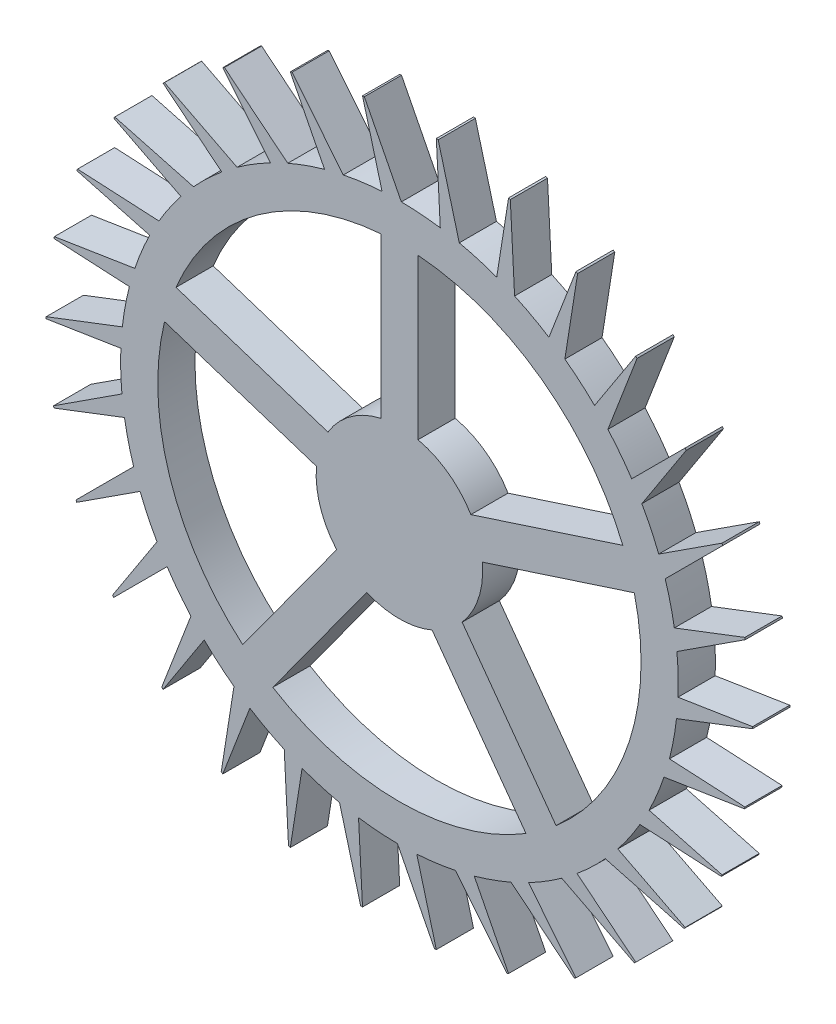
from build123d import *

# Parameters (mm, degrees)
BOSS_EXTRUDE1_DEPTH = 10


with BuildPart() as part:
    # Sketch1 → Boss-Extrude1 (new body)
    with BuildSketch(Plane.XY):
        with BuildLine():
            Line((74.53305982, -8.356015427), (94.998684211, -0.499998269))
            ThreePointArc((94.998684211, -0.499998269), (94.999671052, -0.25), (95, 0))
            Line((95, 0), (74.932623244, -3.178360236))
            ThreePointArc((74.932623244, -3.178360236), (74.971224988, 2.077359809), (74.641646935, 7.322878048))
            Line((74.641646935, 7.322878048), (93.026690519, 19.262264953))
            ThreePointArc((93.026690519, 19.262264953), (92.975678233, 19.507005335), (92.92402207, 19.751610628))
            Line((92.92402207, 19.751610628), (73.955983893, 12.470462957))
            ThreePointArc((73.955983893, 12.470462957), (72.901016456, 17.619358663), (71.488035907, 22.681726613))
            Line((71.488035907, 22.681726613), (86.98898406, 38.182674765))
            ThreePointArc((86.98898406, 38.182674765), (86.888202128, 38.411460933), (86.786818476, 38.639981092))
            Line((86.786818476, 38.639981092), (69.747113167, 27.574267078))
            ThreePointArc((69.747113167, 27.574267078), (67.644683687, 32.391306996), (65.210054673, 37.049274885))
            Line((65.210054673, 37.049274885), (77.149441578, 55.43431847))
            ThreePointArc((77.149441578, 55.43431847), (77.003294654, 55.637151368), (76.856614466, 55.839598968))
            Line((76.856614466, 55.839598968), (62.489958911, 41.472943413))
            ThreePointArc((62.489958911, 41.472943413), (59.431953645, 45.747599783), (56.082081137, 49.797592063))
            Line((56.082081137, 49.797592063), (63.938098295, 70.263216454))
            ThreePointArc((63.938098295, 70.263216454), (63.752973701, 70.431231313), (63.567407604, 70.59875842))
            Line((63.567407604, 70.59875842), (52.50169359, 53.559053111))
            ThreePointArc((52.50169359, 53.559053111), (48.621762043, 57.104502938), (44.503051544, 60.369515513))
            Line((44.503051544, 60.369515513), (47.932353308, 82.021274718))
            ThreePointArc((47.932353308, 82.021274718), (47.716341877, 82.147128482), (47.5, 82.27241336))
            Line((47.5, 82.27241336), (40.218852329, 63.304375183))
            ThreePointArc((40.218852329, 63.304375183), (35.686566127, 65.965665297), (30.979025049, 68.30300145))
            Line((30.979025049, 68.30300145), (29.831734476, 90.194609696))
            ThreePointArc((29.831734476, 90.194609696), (29.594276944, 90.272801951), (29.356614466, 90.350369048))
            Line((29.356614466, 90.350369048), (26.178254229, 70.282992292))
            ThreePointArc((26.178254229, 70.282992292), (21.191696027, 71.943811544), (16.101066505, 73.251318469))
            Line((16.101066505, 73.251318469), (10.427325699, 94.426007428))
            ThreePointArc((10.427325699, 94.426007428), (10.1788001, 94.453120798), (9.93020401, 94.47958006))
            Line((9.93020401, 94.47958006), (10.993540803, 74.189905382))
            ThreePointArc((10.993540803, 74.189905382), (5.770647123, 74.777668002), (0.519414094, 74.998201372))
            Line((0.519414094, 74.998201372), (-9.432807247, 94.530535529))
            ThreePointArc((-9.432807247, 94.530535529), (-9.681539152, 94.50538503), (-9.93020401, 94.47958006))
            Line((-9.93020401, 94.47958006), (-4.67164311, 74.854363605))
            ThreePointArc((-4.67164311, 74.854363605), (-9.902606752, 74.343381545), (-15.084939206, 73.467302994))
            Line((-15.084939206, 73.467302994), (-28.880681253, 90.50362562))
            ThreePointArc((-28.880681253, 90.50362562), (-29.118748686, 90.427310449), (-29.356614466, 90.350369048))
            Line((-29.356614466, 90.350369048), (-20.132653802, 72.247326946))
            ThreePointArc((-20.132653802, 72.247326946), (-25.143069193, 70.659932575), (-30.030008276, 68.72553094))
            Line((-30.030008276, 68.72553094), (-47.066330903, 82.521272987))
            ThreePointArc((-47.066330903, 82.521272987), (-47.283329175, 82.397128482), (-47.5, 82.27241336))
            Line((-47.5, 82.27241336), (-34.713770915, 66.48273542))
            ThreePointArc((-34.713770915, 66.48273542), (-39.284658861, 63.888305488), (-43.662621886, 60.980123402))
            Line((-43.662621886, 60.980123402), (-63.194956043, 70.932344743))
            ThreePointArc((-63.194956043, 70.932344743), (-63.381401289, 70.765796616), (-63.567407604, 70.59875842))
            Line((-63.567407604, 70.59875842), (-47.777729664, 57.812529335))
            ThreePointArc((-47.777729664, 57.812529335), (-51.709320428, 54.324452881), (-55.386969402, 50.569591856))
            Line((-55.386969402, 50.569591856), (-76.561658361, 56.243332663))
            ThreePointArc((-76.561658361, 56.243332663), (-76.709402028, 56.041659866), (-76.856614466, 55.839598968))
            Line((-76.856614466, 55.839598968), (-58.753572364, 46.615638304))
            ThreePointArc((-58.753572364, 46.615638304), (-61.874036564, 42.386361005), (-64.690640579, 37.948926486))
            Line((-64.690640579, 37.948926486), (-86.582248825, 39.09621706))
            ThreePointArc((-86.582248825, 39.09621706), (-86.684833806, 38.868233661), (-86.786818476, 38.639981092))
            Line((-86.786818476, 38.639981092), (-67.161602021, 33.381420192))
            ThreePointArc((-67.161602021, 33.381420192), (-69.334560397, 28.595781762), (-71.167020343, 23.66971093))
            Line((-71.167020343, 23.66971093), (-92.818779548, 20.240409167))
            ThreePointArc((-92.818779548, 20.240409167), (-92.871722387, 19.996079136), (-92.92402207, 19.751610628))
            Line((-92.92402207, 19.751610628), (-72.634347392, 18.688273835))
            ThreePointArc((-72.634347392, 18.688273835), (-73.764831237, 13.555429637), (-74.53305982, 8.356015427))
            Line((-74.53305982, 8.356015427), (-94.998684211, 0.499998269))
            ThreePointArc((-94.998684211, 0.499998269), (-94.999671052, 0.25), (-95, 0))
            Line((-95, 0), (-74.932623244, 3.178360236))
            ThreePointArc((-74.932623244, 3.178360236), (-74.971224988, -2.077359809), (-74.641646935, -7.322878048))
            Line((-74.641646935, -7.322878048), (-93.026690519, -19.262264953))
            ThreePointArc((-93.026690519, -19.262264953), (-92.975678233, -19.507005335), (-92.92402207, -19.751610628))
            Line((-92.92402207, -19.751610628), (-73.955983893, -12.470462957))
            ThreePointArc((-73.955983893, -12.470462957), (-72.901016456, -17.619358663), (-71.488035907, -22.681726613))
            Line((-71.488035907, -22.681726613), (-86.98898406, -38.182674765))
            ThreePointArc((-86.98898406, -38.182674765), (-86.888202128, -38.411460933), (-86.786818476, -38.639981092))
            Line((-86.786818476, -38.639981092), (-69.747113167, -27.574267078))
            ThreePointArc((-69.747113167, -27.574267078), (-67.644683687, -32.391306996), (-65.210054673, -37.049274885))
            Line((-65.210054673, -37.049274885), (-77.149441578, -55.43431847))
            ThreePointArc((-77.149441578, -55.43431847), (-77.003294654, -55.637151368), (-76.856614466, -55.839598968))
            Line((-76.856614466, -55.839598968), (-62.489958911, -41.472943413))
            ThreePointArc((-62.489958911, -41.472943413), (-59.431953645, -45.747599783), (-56.082081137, -49.797592063))
            Line((-56.082081137, -49.797592063), (-63.938098295, -70.263216454))
            ThreePointArc((-63.938098295, -70.263216454), (-63.752973701, -70.431231313), (-63.567407604, -70.59875842))
            Line((-63.567407604, -70.59875842), (-52.50169359, -53.559053111))
            ThreePointArc((-52.50169359, -53.559053111), (-48.621762043, -57.104502938), (-44.503051544, -60.369515513))
            Line((-44.503051544, -60.369515513), (-47.932353308, -82.021274718))
            ThreePointArc((-47.932353308, -82.021274718), (-47.716341877, -82.147128482), (-47.5, -82.27241336))
            Line((-47.5, -82.27241336), (-40.218852329, -63.304375183))
            ThreePointArc((-40.218852329, -63.304375183), (-35.686566127, -65.965665297), (-30.979025049, -68.30300145))
            Line((-30.979025049, -68.30300145), (-29.831734476, -90.194609696))
            ThreePointArc((-29.831734476, -90.194609696), (-29.594276944, -90.272801951), (-29.356614466, -90.350369048))
            Line((-29.356614466, -90.350369048), (-26.178254229, -70.282992292))
            ThreePointArc((-26.178254229, -70.282992292), (-21.191696027, -71.943811544), (-16.101066505, -73.251318469))
            Line((-16.101066505, -73.251318469), (-10.427325699, -94.426007428))
            ThreePointArc((-10.427325699, -94.426007428), (-10.1788001, -94.453120798), (-9.93020401, -94.47958006))
            Line((-9.93020401, -94.47958006), (-10.993540803, -74.189905382))
            ThreePointArc((-10.993540803, -74.189905382), (-5.770647123, -74.777668002), (-0.519414094, -74.998201372))
            Line((-0.519414094, -74.998201372), (9.432807247, -94.530535529))
            ThreePointArc((9.432807247, -94.530535529), (9.681539152, -94.50538503), (9.93020401, -94.47958006))
            Line((9.93020401, -94.47958006), (4.67164311, -74.854363605))
            ThreePointArc((4.67164311, -74.854363605), (9.902606752, -74.343381545), (15.084939206, -73.467302994))
            Line((15.084939206, -73.467302994), (28.880681253, -90.50362562))
            ThreePointArc((28.880681253, -90.50362562), (29.118748686, -90.427310449), (29.356614466, -90.350369048))
            Line((29.356614466, -90.350369048), (20.132653802, -72.247326946))
            ThreePointArc((20.132653802, -72.247326946), (25.143069193, -70.659932575), (30.030008276, -68.72553094))
            Line((30.030008276, -68.72553094), (47.066330903, -82.521272987))
            ThreePointArc((47.066330903, -82.521272987), (47.283329175, -82.397128482), (47.5, -82.27241336))
            Line((47.5, -82.27241336), (34.713770915, -66.48273542))
            ThreePointArc((34.713770915, -66.48273542), (39.284658861, -63.888305488), (43.662621886, -60.980123402))
            Line((43.662621886, -60.980123402), (63.194956043, -70.932344743))
            ThreePointArc((63.194956043, -70.932344743), (63.381401289, -70.765796616), (63.567407604, -70.59875842))
            Line((63.567407604, -70.59875842), (47.777729664, -57.812529335))
            ThreePointArc((47.777729664, -57.812529335), (51.709320428, -54.324452881), (55.386969402, -50.569591856))
            Line((55.386969402, -50.569591856), (76.561658361, -56.243332663))
            ThreePointArc((76.561658361, -56.243332663), (76.709402028, -56.041659866), (76.856614466, -55.839598968))
            Line((76.856614466, -55.839598968), (58.753572364, -46.615638304))
            ThreePointArc((58.753572364, -46.615638304), (61.874036564, -42.386361005), (64.690640579, -37.948926486))
            Line((64.690640579, -37.948926486), (86.582248825, -39.09621706))
            ThreePointArc((86.582248825, -39.09621706), (86.684833806, -38.868233661), (86.786818476, -38.639981092))
            Line((86.786818476, -38.639981092), (67.161602021, -33.381420192))
            ThreePointArc((67.161602021, -33.381420192), (69.334560397, -28.595781762), (71.167020343, -23.66971093))
            Line((71.167020343, -23.66971093), (92.818779548, -20.240409167))
            ThreePointArc((92.818779548, -20.240409167), (92.871722387, -19.996079136), (92.92402207, -19.751610628))
            Line((92.92402207, -19.751610628), (72.634347392, -18.688273835))
            ThreePointArc((72.634347392, -18.688273835), (73.764831237, -13.555429637), (74.53305982, -8.356015427))
        make_face()
        with BuildLine():
            ThreePointArc((-42.137923036, -49.49136735), (-61.818673559, -20.086104634), (-63.180591688, 15.271307538))
            Line((-63.180591688, 15.271307538), (-22.311246657, 1.992052365))
            ThreePointArc((-22.311246657, 1.992052365), (-21.303665965, -6.921980674), (-16.879278709, -14.725825962))
            Line((-16.879278709, -14.725825962), (-42.137923036, -49.49136735))
        make_face(mode=Mode.SUBTRACT)
        with BuildLine():
            ThreePointArc((63.180591688, 15.271307538), (61.818673559, -20.086104634), (42.137923036, -49.49136735))
            Line((42.137923036, -49.49136735), (16.879278709, -14.725825962))
            ThreePointArc((16.879278709, -14.725825962), (21.303665965, -6.921980674), (22.311246657, 1.992052365))
            Line((22.311246657, 1.992052365), (63.180591688, 15.271307538))
        make_face(mode=Mode.SUBTRACT)
        with BuildLine():
            ThreePointArc((34.047753093, -55.369219873), (0, -65), (-34.047753093, -55.369219873))
            Line((-34.047753093, -55.369219873), (-8.789108765, -20.603678485))
            ThreePointArc((-8.789108765, -20.603678485), (0, -22.4), (8.789108765, -20.603678485))
            Line((8.789108765, -20.603678485), (34.047753093, -55.369219873))
        make_face(mode=Mode.SUBTRACT)
        with BuildLine():
            ThreePointArc((-60.090421745, 24.781872701), (-38.206041399, 52.586104634), (-5, 64.807406984))
            Line((-5, 64.807406984), (-5, 21.834834554))
            ThreePointArc((-5, 21.834834554), (-13.166389651, 18.121980674), (-19.221076713, 11.502617528))
            Line((-19.221076713, 11.502617528), (-60.090421745, 24.781872701))
        make_face(mode=Mode.SUBTRACT)
        with BuildLine():
            ThreePointArc((5, 64.807406984), (38.206041399, 52.586104634), (60.090421745, 24.781872701))
            Line((60.090421745, 24.781872701), (19.221076713, 11.502617528))
            ThreePointArc((19.221076713, 11.502617528), (13.166389651, 18.121980674), (5, 21.834834554))
            Line((5, 21.834834554), (5, 64.807406984))
        make_face(mode=Mode.SUBTRACT)
    extrude(amount=BOSS_EXTRUDE1_DEPTH)


solid = part.part
